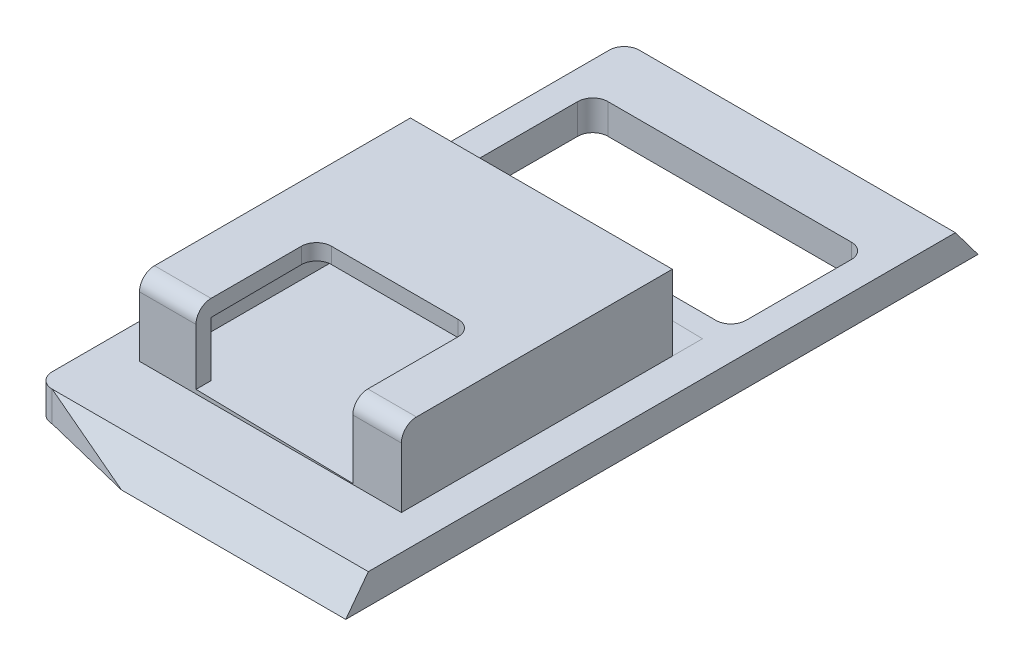
from build123d import *

# Parameters (mm, degrees)
CROQUIS1_W              = 22
CROQUIS1_H              = 39
CROQUIS1_W_2            = 18.17669517928964
CROQUIS1_H_2            = 8.999999999999996
SALIENTE_EXTRUIR1_DEPTH = 2
REDONDEO1_R             = 1
REDONDEO2_R             = 1
SALIENTE_EXTRUIR2_DEPTH = 5
SALIENTE_EXTRUIR4_DEPTH = 15.4
CORTAR_EXTRUIR2_DEPTH   = 8
REDONDEO3_R             = 1
SALIENTE_EXTRUIR5_DEPTH = 20.000000000000004
SALIENTE_EXTRUIR6_DEPTH = 14.9
SALIENTE_EXTRUIR7_DEPTH = 14.9
SALIENTE_EXTRUIR8_DEPTH = 2
CORTAR_EXTRUIR3_DEPTH   = 7
SALIENTE_EXTRUIR9_DEPTH = 2
CORTAR_EXTRUIR4_DEPTH   = 8


with BuildPart() as part:
    # Croquis1 → Saliente-Extruir1 (new body)
    with BuildSketch(Plane(origin=(0, 0, 0), x_dir=(1, 0, 0), z_dir=(0, 1, 0))):
        with Locations((11, 19.5)):
            Rectangle(CROQUIS1_W, CROQUIS1_H)
        with Locations((11.000000000000002, 30.5)):
            Rectangle(CROQUIS1_W_2, CROQUIS1_H_2, mode=Mode.SUBTRACT)
        Polygon((2.2999999999999914, 4.496684869244013), (19.7, 4.496684869244013), (19.7, 22.496684869244014), (18.7, 22.496684869244014), (18.7, 5.496684869244012), (3.299999999999997, 5.496684869244012), (3.299999999999997, 22.49668486924401), (2.2999999999999914, 22.49668486924401), align=None, mode=Mode.SUBTRACT)
    extrude(amount=SALIENTE_EXTRUIR1_DEPTH)

    # Redondeo1
    redondeo1_edges = [part.edges().sort_by_distance(p)[0] for p in [
        (0, 1, -39),
        (0, 1, 0),
    ]]
    fillet(redondeo1_edges, radius=REDONDEO1_R)

    # Redondeo2
    redondeo2_edges = [part.edges().sort_by_distance(p)[0] for p in [
        (1.9116524103551802, 1, -35),
        (1.9116524103551802, 1, -26.000000000000004),
        (20.088347589644822, 1, -26.000000000000004),
        (20.088347589644822, 1, -35),
    ]]
    fillet(redondeo2_edges, radius=REDONDEO2_R)



with BuildPart() as body_2:
    # Croquis8 → Saliente-Extruir2 (new body)
    with BuildSketch(Plane(origin=(0, 2, 0), x_dir=(1, 0, 0), z_dir=(0, 1, 0))):
        Polygon((2.2999999999999914, 22.49668486924401), (3.299999999999997, 22.49668486924401), (3.299999999999997, 5.496684869244012), (18.7, 5.496684869244012), (18.7, 22.496684869244014), (19.7, 22.496684869244014), (19.7, 4.496684869244013), (2.2999999999999914, 4.496684869244013), align=None)
    extrude(amount=SALIENTE_EXTRUIR2_DEPTH)

    # Croquis3D1 → Saliente-Extruir4 (add)
    with BuildSketch(Plane(origin=(18.7, 6.007354442998164, -22.496684869244014), x_dir=(0, 0.058291627055225136, 0.9982995974231657), z_dir=(1, 0, 0))):
        Polygon((0, 0), (16.964879958528087, 1.097364583913252), (17.028956080800597, 0), (0.05786292460677727, -0.9909576599388273), align=None)
    extrude(amount=-SALIENTE_EXTRUIR4_DEPTH)

    # Croquis3D2 → Cortar-Extruir2 (cut)
    with BuildSketch(Plane(origin=(6.0546274348603735, 7, -4.496684869244013), x_dir=(0.9015563394045935, -0.4326617233814304, 0), z_dir=(0, 0, -1))):
        Polygon((0, 0), (2.1633086169071523, 4.507781697022968), (11.556372403185868, 0), (9.393063786278717, -4.507781697022968), align=None)
    extrude(amount=CORTAR_EXTRUIR2_DEPTH, mode=Mode.SUBTRACT)

    # Redondeo3
    redondeo3_edges = [body_2.edges().sort_by_distance(p)[0] for p in [
        (6.0546274348603735, 6.4723277606850065, -12.496684869244014),
        (16.47334823547289, 6.4723277606850065, -12.496684869244014),
        (18.086674117736443, 7, -4.496684869244013),
        (4.177313717430181, 7, -4.496684869244013),
    ]]
    fillet(redondeo3_edges, radius=REDONDEO3_R)


with BuildPart() as part_1:
    add(part.part)

    add(body_2.part)  # Saliente-Extruir5 merges body 2
    # Croquis15 → Saliente-Extruir5 (add)
    with BuildSketch(Plane(origin=(0, 0, -4.496684869244013), x_dir=(-1, 0, 0), z_dir=(0, 0, -1))):
        Polygon((-19.7, 2), (-19.7, 0), (-2.2999999999999914, 0), (-2.2999999999999914, 2.336560166952495), align=None)
    extrude(amount=SALIENTE_EXTRUIR5_DEPTH)

    # Croquis16 → Saliente-Extruir6 (add)
    with BuildSketch(Plane(origin=(22, 0, 0), x_dir=(0, 0, -1), z_dir=(1, 0, 0))):
        Polygon((0, 0), (-1.5, -1.8e-16), (0, 2), align=None)
    extrude(amount=-SALIENTE_EXTRUIR6_DEPTH)

    # Croquis17 → Saliente-Extruir7 (add)
    with BuildSketch(Plane(origin=(22, 0, 0), x_dir=(0, 0, -1), z_dir=(1, 0, 0))):
        Polygon((39, 0), (40.5, 0), (39, 2), align=None)
    extrude(amount=-SALIENTE_EXTRUIR7_DEPTH)

    # Croquis18 → Saliente-Extruir8 (add)
    with BuildSketch(Plane.XZ):
        Polygon((7.099999999999999, 1.5), (0.9999999999999966, 0), (7.099999999999999, 0), align=None)
    extrude(amount=-SALIENTE_EXTRUIR8_DEPTH)

    # Croquis20 → Cortar-Extruir3 (cut)
    with BuildSketch(Plane(origin=(7.099999999999999, 0, 0), x_dir=(0, 0, -1), z_dir=(1, 0, 0))):
        Polygon((0, 2), (-1.5, 2), (-1.5, 0), align=None)
    extrude(amount=-CORTAR_EXTRUIR3_DEPTH, mode=Mode.SUBTRACT)

    # Croquis22 → Saliente-Extruir9 (add)
    with BuildSketch(Plane(origin=(0, 2, 0), x_dir=(1, 0, 0), z_dir=(0, 1, 0))):
        Polygon((7.099999999999999, 40.5), (7.099999999999999, 39), (1, 39), align=None)
    extrude(amount=-SALIENTE_EXTRUIR9_DEPTH)

    # Croquis23 → Cortar-Extruir4 (cut)
    with BuildSketch(Plane(origin=(7.099999999999999, 0, 0), x_dir=(0, 0, -1), z_dir=(1, 0, 0))):
        Polygon((40.5, 0), (39, 2), (40.5, 2), align=None)
    extrude(amount=-CORTAR_EXTRUIR4_DEPTH, mode=Mode.SUBTRACT)


solid = part_1.part
